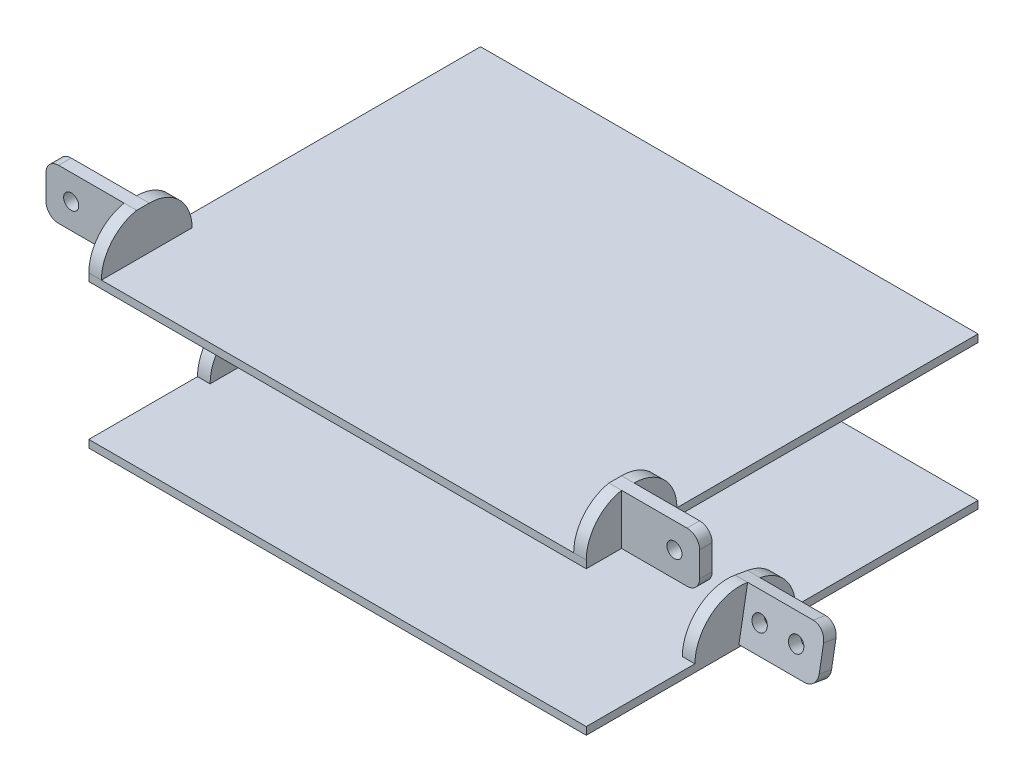
from build123d import *

# Parameters (mm, degrees)
SKETCH1_R                        = 3
LOWER_LEFT_TAB_DEPTH             = 5
BOTTOM_START                     = -5
SKETCH2_W                        = 157
SKETCH2_H                        = 3
BOTTOM_PLATE_EXTRUDE_DEPTH       = 98.75
BOTTOM_TAB_SUPPORT_EXTRUDE_DEPTH = 5
SKETCH5_R                        = 3
TOP_TAB_EXTRUDE_DEPTH            = 5
TOP_START                        = -5
SKETCH6_W                        = 155.527036446
SKETCH6_H                        = 3
TOP_PLATE_EXTRUDE_DEPTH          = 98.75
TOP_TAB_SUPPORT_EXTRUDE_DEPTH    = 5
SKETCH8_W                        = 197.5
SKETCH8_H                        = 1.472963554
BOTTOM_PLATE_WAS_TOO_LONG_DEPTH  = 10


with BuildPart() as part:
    # Sketch1 → Lower left tab (new body)
    with BuildSketch(Plane(origin=(0, 0, 0), x_dir=(1, 0, 0), z_dir=(0, 0.17364817766693072, 0.984807753012208))):
        with BuildLine():
            Line((-124.75, 10), (-93.75, 10))
            Line((-93.75, 10), (-93.75, -10))
            Line((-93.75, -10), (-124.75, -10))
            ThreePointArc((-124.75, -10), (-128.285533906, -8.535533906), (-129.75, -5))
            Line((-129.75, -5), (-129.75, 5))
            ThreePointArc((-129.75, 5), (-128.285533906, 8.535533906), (-124.75, 10))
        make_face()
        with Locations(Location((-119.75, 0, 0), (0, 0, 270))):
            Circle(SKETCH1_R, mode=Mode.SUBTRACT)
        with Locations(Location((-105.25, 0, 0), (0, 0, 270))):
            Circle(SKETCH1_R, mode=Mode.SUBTRACT)
    lower_left_tab = extrude(amount=LOWER_LEFT_TAB_DEPTH)

    # Sketch2 → Bottom plate extrude (add)
    with BuildSketch(Plane(origin=(-93.75, 0, 0), x_dir=(0, 0, -1), z_dir=(1, 0, 0)).offset(BOTTOM_START)):
        with Locations((9.763518223, -8.34807753)):
            Rectangle(SKETCH2_W, SKETCH2_H)
    bottom_plate_extrude = extrude(amount=BOTTOM_PLATE_EXTRUDE_DEPTH)

    # Sketch4 → Bottom tab support extrude (add)
    with BuildSketch(Plane(origin=(-93.75, 0, 0), x_dir=(0, 0, -1), z_dir=(1, 0, 0))):
        with BuildLine():
            Line((15.74621933, -6.84807753), (-1.207500835, -6.84807753))
            Line((-1.207500835, -6.84807753), (1.736481777, 9.84807753))
            ThreePointArc((1.736481777, 9.84807753), (11.779802288, 4.04956373), (15.74621933, -6.84807753))
        make_face()
        with BuildLine():
            Line((-6.284633894, -6.84807753), (-3.187556988, 10.716318418))
            ThreePointArc((-3.187556988, 10.716318418), (-17.748979146, 6.814597111), (-24.119988962, -6.84807753))
            Line((-24.119988962, -6.84807753), (-6.284633894, -6.84807753))
        make_face()
    bottom_tab_support_extrude = extrude(amount=-BOTTOM_TAB_SUPPORT_EXTRUDE_DEPTH)


with BuildPart() as body_2:
    # Sketch5 → Top tab extrude (new body)
    with BuildSketch(Plane.XY.offset(48.263518223)):
        with BuildLine():
            Line((-124.75, 67.40192247), (-93.75, 67.40192247))
            Line((-93.75, 67.40192247), (-93.75, 47.40192247))
            Line((-93.75, 47.40192247), (-124.75, 47.40192247))
            ThreePointArc((-124.75, 47.40192247), (-128.285533906, 48.866388564), (-129.75, 52.40192247))
            Line((-129.75, 52.40192247), (-129.75, 62.40192247))
            ThreePointArc((-129.75, 62.40192247), (-128.285533906, 65.937456376), (-124.75, 67.40192247))
        make_face()
        with Locations((-119.75, 57.40192247)):
            Circle(SKETCH5_R, mode=Mode.SUBTRACT)
    top_tab_extrude = extrude(amount=TOP_TAB_EXTRUDE_DEPTH)

    # Sketch6 → Top plate extrude (add)
    with BuildSketch(Plane(origin=(-93.75, 0, 0), x_dir=(0, 0, -1), z_dir=(1, 0, 0)).offset(TOP_START)):
        with Locations((10.5, 48.90192247)):
            Rectangle(SKETCH6_W, SKETCH6_H)
    top_plate_extrude = extrude(amount=TOP_PLATE_EXTRUDE_DEPTH)

    # Sketch7 → Top tab support extrude (add)
    with BuildSketch(Plane(origin=(-93.75, 0, 0), x_dir=(0, 0, -1), z_dir=(1, 0, 0))):
        with BuildLine():
            Line((-48.263518223, 50.40192247), (-48.263518223, 67.40192247))
            ThreePointArc((-48.263518223, 67.40192247), (-36.242702943, 62.42273775), (-31.263518223, 50.40192247))
            Line((-31.263518223, 50.40192247), (-48.263518223, 50.40192247))
        make_face()
        with BuildLine():
            Line((-53.263518223, 50.40192247), (-53.263518223, 67.40192247))
            ThreePointArc((-53.263518223, 67.40192247), (-63.31302409, 61.413280243), (-67.263518223, 50.40192247))
            Line((-67.263518223, 50.40192247), (-53.263518223, 50.40192247))
        make_face()
    top_tab_support_extrude = extrude(amount=-TOP_TAB_SUPPORT_EXTRUDE_DEPTH)


with BuildPart() as part_1:
    add(part.part)

    add(body_2.part)  # Mirror 2 merges body 2
    # Mirror 2: Lower left tab, Bottom plate extrude, Bottom tab support extrude, Top tab extrude, Top plate extrude, Top tab support extrude across plane
    add(lower_left_tab.mirror(Plane(origin=(0, 0, 0), x_dir=(0, 0, 1), z_dir=(1, 0, 0))))
    add(bottom_plate_extrude.mirror(Plane(origin=(0, 0, 0), x_dir=(0, 0, 1), z_dir=(1, 0, 0))))
    add(bottom_tab_support_extrude.mirror(Plane(origin=(0, 0, 0), x_dir=(0, 0, 1), z_dir=(1, 0, 0))))
    add(top_tab_extrude.mirror(Plane(origin=(0, 0, 0), x_dir=(0, 0, 1), z_dir=(1, 0, 0))))
    add(top_plate_extrude.mirror(Plane(origin=(0, 0, 0), x_dir=(0, 0, 1), z_dir=(1, 0, 0))))
    add(top_tab_support_extrude.mirror(Plane(origin=(0, 0, 0), x_dir=(0, 0, 1), z_dir=(1, 0, 0))))

    # Sketch8 → Bottom plate was too long (cut)
    with BuildSketch(Plane(origin=(0, -6.84807753, 0), x_dir=(1, 0, 0), z_dir=(0, 1, 0))):
        with Locations((0, -68)):
            Rectangle(SKETCH8_W, SKETCH8_H)
    extrude(amount=-BOTTOM_PLATE_WAS_TOO_LONG_DEPTH, mode=Mode.SUBTRACT)


solid = part_1.part
